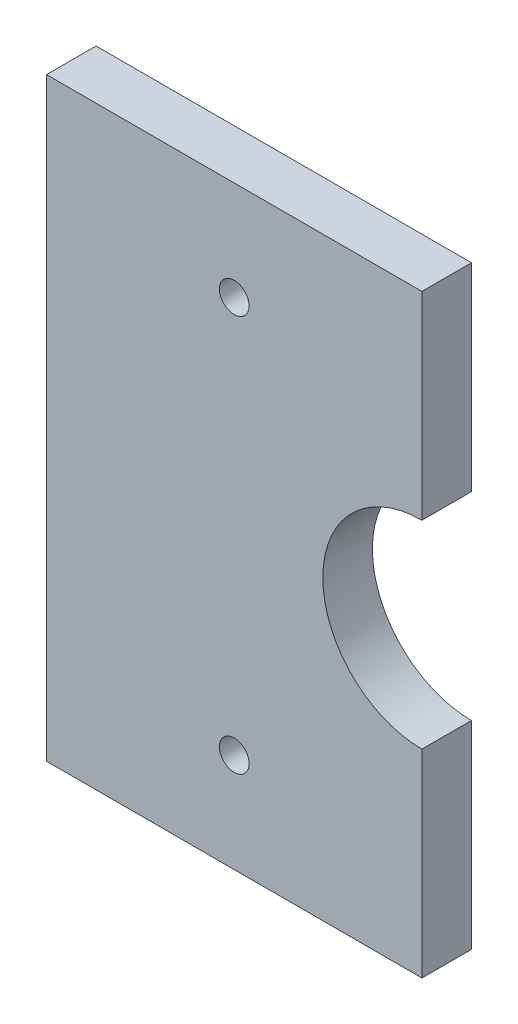
from build123d import *

# Parameters (mm, degrees)
SKETCH_1_W          = 75.760831706
SKETCH_1_H          = 120
SKETCH_1_R          = 3
EXTRUDE_1_DEPTH     = 10
SKETCH_5_R          = 20
CUT_EXTRUDE_1_DEPTH = 20


with BuildPart() as part:
    # 草图1 → 凸台-拉伸1 (new body)
    # profile 1 of 2: a face of its own
    with BuildSketch(Plane.XY):
        with BuildLine():
            Line((0, -37.880415853), (0, 37.880415853))
            ThreePointArc((0, 37.880415853), (-37.880415853, 0), (0, -37.880415853))
        make_face()
    # profile 2 of 2: a face of its own
    with BuildSketch(Plane.XY):
        with Locations((-37.880415853, 0)):
            Rectangle(SKETCH_1_W, SKETCH_1_H)
        with Locations((-37.880415853, -40)):
            Circle(SKETCH_1_R, mode=Mode.SUBTRACT)
        with Locations((-37.880415853, 40)):
            Circle(SKETCH_1_R, mode=Mode.SUBTRACT)
    extrude(amount=EXTRUDE_1_DEPTH)

    # 草图5 → 切除-拉伸1 (cut)
    with BuildSketch(Plane.XY.offset(10)):
        Circle(SKETCH_5_R)
    extrude(amount=-CUT_EXTRUDE_1_DEPTH, mode=Mode.SUBTRACT)


solid = part.part
